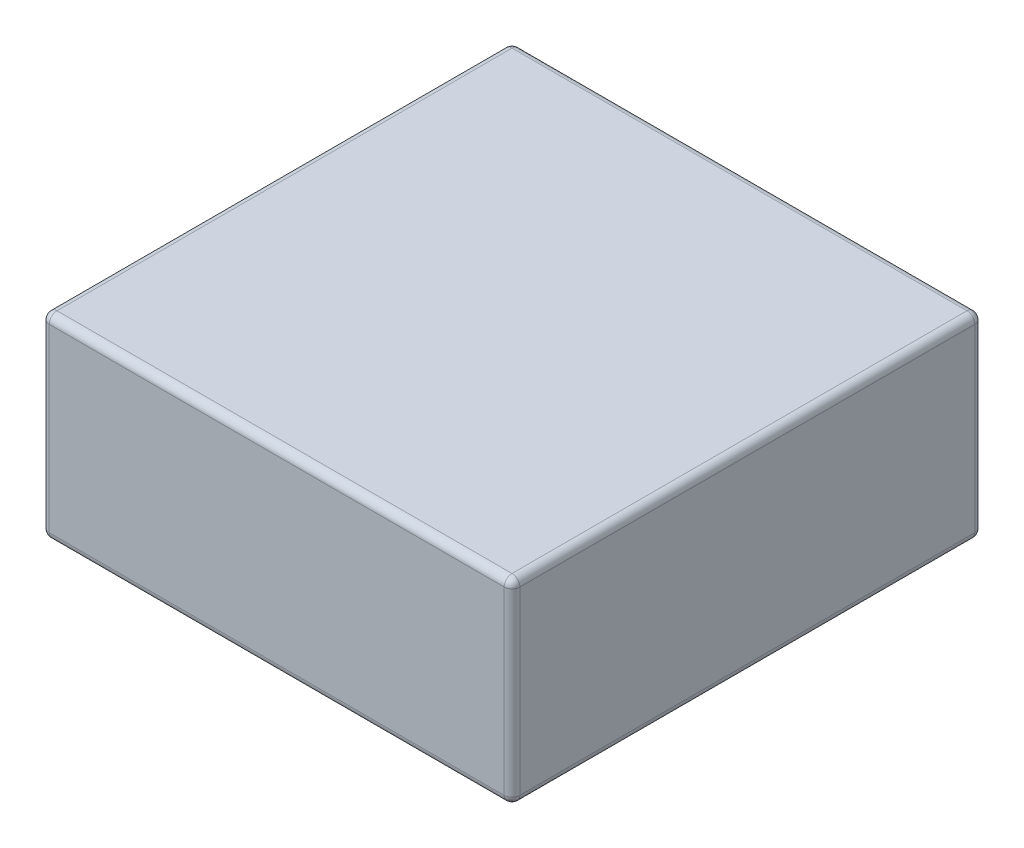
from build123d import *

# Parameters (mm, degrees)
SKETCH1_W           = 60
SKETCH1_H           = 25
BOSS_EXTRUDE1_DEPTH = 60
FILLET1_R           = 1
FILLET2_R           = 1


with BuildPart() as part:
    # Sketch1 → Boss-Extrude1 (new body)
    with BuildSketch(Plane(origin=(0, 0, 0), x_dir=(0, 0, -1), z_dir=(1, 0, 0))):
        Rectangle(SKETCH1_W, SKETCH1_H)
    extrude(amount=-BOSS_EXTRUDE1_DEPTH)

    # Fillet1
    fillet1_edges = [part.edges().sort_by_distance(p)[0] for p in [
        (-60, -12.5, 0),
        (0, -12.5, 0),
        (0, 12.5, 0),
        (-60, 12.5, 0),
    ]]
    fillet(fillet1_edges, radius=FILLET1_R)

    # Fillet2
    fillet2_edges = [part.edges().sort_by_distance(p)[0] for p in [
        (-30, 12.5, -30),
        (-30, 12.5, 30),
        (0, 0, 30),
        (-60, 0, 30),
        (-30, -12.5, 30),
        (-0.292893219, 12.207106781, 30),
        (-0.292893219, -12.207106781, 30),
        (-59.707106781, -12.207106781, 30),
        (-59.707106781, 12.207106781, 30),
        (-60, 0, -30),
        (0, 0, -30),
        (-30, -12.5, -30),
        (-0.292893219, 12.207106781, -30),
        (-0.292893219, -12.207106781, -30),
        (-59.707106781, -12.207106781, -30),
        (-59.707106781, 12.207106781, -30),
    ]]
    fillet(fillet2_edges, radius=FILLET2_R)


solid = part.part
